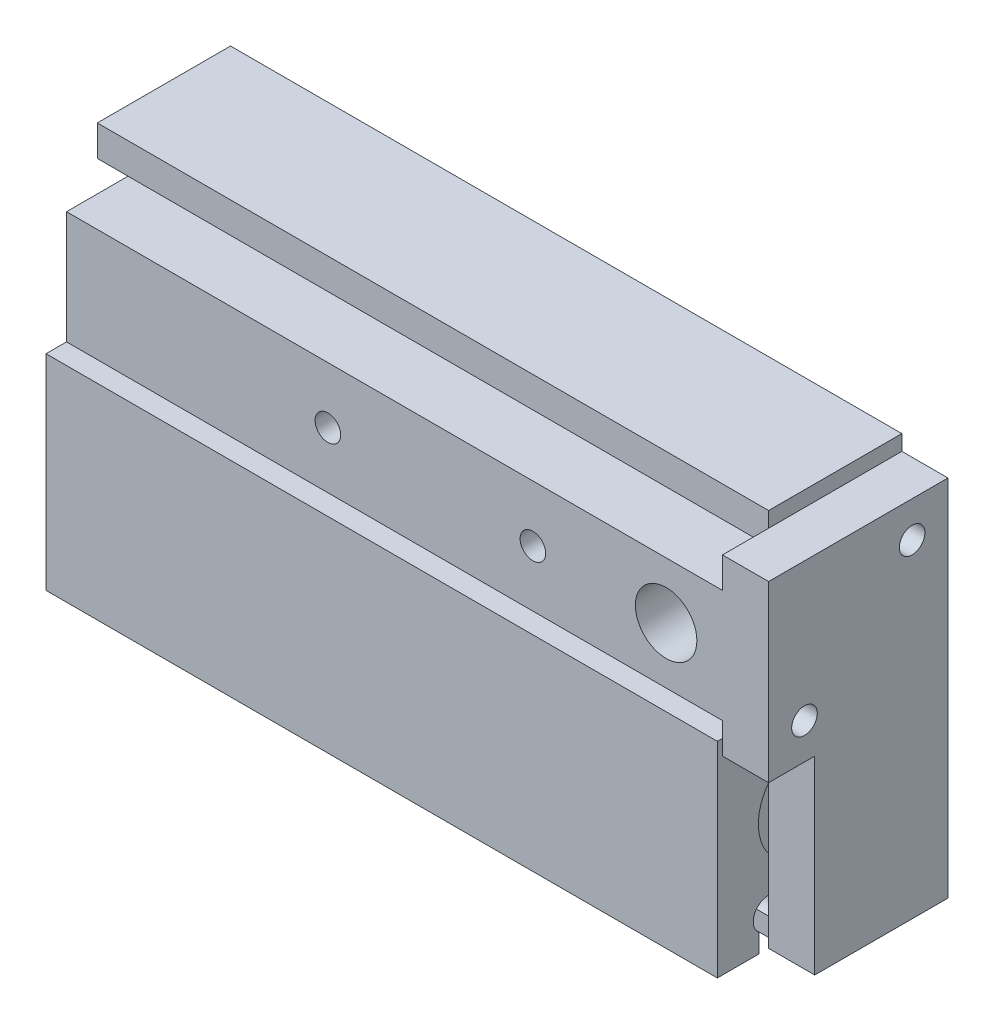
from build123d import *

# Parameters (mm, degrees)
SKETCH_1_W                     = 18
SKETCH_1_H                     = 37
EXTRUDE_1_DEPTH                = 65.5
SKETCH_2_R                     = 5
CUT_EXTRUDE_1_DEPTH            = 0.5
CUT_EXTRUDE_START              = -0.5
SKETCH_3_R                     = 5
CUT_EXTRUDE_2_DEPTH            = 0.5
SKETCH_4_R                     = 1.5
CUT_EXTRUDE_3_DEPTH            = 78.351470574
SKETCH_5_W                     = 1.835428096
SKETCH_5_H                     = 2.75652024
CUT_EXTRUDE_4_DEPTH            = 78.351470574
SKETCH_6_W                     = 5
SKETCH_6_H                     = 17
CUT_EXTRUDE_5_DEPTH            = 78.351470574
SKETCH_7_W                     = 8
SKETCH_7_H                     = 12
CUT_EXTRUDE_6_DEPTH            = 78.351470574
SKETCH_8_R                     = 2.5
EXTRUDE_2_DEPTH                = 1.5
SKETCH_9_W                     = 17.5
SKETCH_9_H                     = 35.5
EXTRUDE_3_DEPTH                = 4.5
SKETCH_10_W                    = 7
SKETCH_10_H                    = 11
EXTRUDE_4_DEPTH                = 64
CUT_EXTRUDE_7_REACH            = 84.061
SKETCH_11_W                    = 4.5
SKETCH_11_H                    = 18.5
HOLE_WIZARD_M3_1_D             = 2.5
HOLE_WIZARD_M3_1_DEPTH         = 7.5
HOLE_WIZARD_M3_1_TIP           = 0.751075774
HOLE_WIZARD_M3_1_2_D           = 3.4
HOLE_WIZARD_M3_1_2_DEPTH       = 5
HOLE_WIZARD_M3_1_2_CBORE_D     = 6.5
HOLE_WIZARD_M3_1_2_CBORE_DEPTH = 3
CUT_EXTRUDE_8_REACH            = 84.172
SKETCH_16_R                    = 3
HOLE_WIZARD_M3_2_D             = 2.5
HOLE_WIZARD_M3_2_DEPTH         = 7.5
HOLE_WIZARD_M3_2_TIP           = 0.751075774


with BuildPart() as part:
    # 草图1 → 凸台-拉伸1 (new body)
    with BuildSketch(Plane(origin=(0, 0, 0), x_dir=(0, 0, -1), z_dir=(1, 0, 0))):
        with Locations((9, 18.5)):
            Rectangle(SKETCH_1_W, SKETCH_1_H)
    extrude(amount=EXTRUDE_1_DEPTH)

    # 草图2 → 切除-拉伸1 (cut)
    with BuildSketch(Plane.ZY):
        with Locations((-9, 11)):
            Circle(SKETCH_2_R)
    extrude(amount=-CUT_EXTRUDE_1_DEPTH, mode=Mode.SUBTRACT)

    # 草图3 → 切除-拉伸2 (cut)
    with BuildSketch(Plane(origin=(65.5, 0, 0), x_dir=(0, 0, -1), z_dir=(1, 0, 0)).offset(CUT_EXTRUDE_START)):
        with Locations(Location((9, 11, 0), (0, 0, 180))):
            Circle(SKETCH_3_R)
    extrude(amount=CUT_EXTRUDE_2_DEPTH, mode=Mode.SUBTRACT)

    # 草图4 → 切除-拉伸3 (cut, through all)
    with BuildSketch(Plane.ZY):
        with Locations((-13, 3)):
            Circle(SKETCH_4_R)
        with Locations(Location((-5, 3, 0), (0, 0, 180))):
            Circle(SKETCH_4_R)
    extrude(amount=-CUT_EXTRUDE_3_DEPTH, mode=Mode.SUBTRACT)

    # 草图5 → 切除-拉伸4 (cut, through all)
    with BuildSketch(Plane.ZY):
        with Locations((-13, 1.37826012)):
            Rectangle(SKETCH_5_W, SKETCH_5_H)
        with Locations((-5, 1.37826012)):
            Rectangle(SKETCH_5_W, SKETCH_5_H)
    extrude(amount=-CUT_EXTRUDE_4_DEPTH, mode=Mode.SUBTRACT)

    # 草图6 → 切除-拉伸5 (cut, through all)
    with BuildSketch(Plane.ZY):
        with Locations((-2.5, 28.5)):
            Rectangle(SKETCH_6_W, SKETCH_6_H)
    extrude(amount=-CUT_EXTRUDE_5_DEPTH, mode=Mode.SUBTRACT)

    # 草图7 → 切除-拉伸6 (cut, through all)
    with BuildSketch(Plane.ZY):
        with Locations((-9, 28)):
            Rectangle(SKETCH_7_W, SKETCH_7_H)
    extrude(amount=-CUT_EXTRUDE_6_DEPTH, mode=Mode.SUBTRACT)

    # 草图8 → 凸台-拉伸2 (add)
    with BuildSketch(Plane(origin=(65, 0, 0), x_dir=(0, 0, -1), z_dir=(1, 0, 0))):
        with Locations((9, 11)):
            Circle(SKETCH_8_R)
    extrude(amount=EXTRUDE_2_DEPTH)

    # 草图9 → 凸台-拉伸3 (add)
    with BuildSketch(Plane(origin=(66.5, 0, 0), x_dir=(0, 0, -1), z_dir=(1, 0, 0))):
        with Locations((8.25, 18.75)):
            Rectangle(SKETCH_9_W, SKETCH_9_H)
    extrude(amount=EXTRUDE_3_DEPTH)

    # 草图10 → 凸台-拉伸4 (add)
    with BuildSketch(Plane.ZY.offset(-66.5)):
        with Locations((-3, 28)):
            Rectangle(SKETCH_10_W, SKETCH_10_H)
    extrude(amount=EXTRUDE_4_DEPTH)

    # 草图11 → 切除-拉伸7 (cut, up to next)
    with BuildSketch(Plane(origin=(71, 0, 0), x_dir=(0, 0, -1), z_dir=(1, 0, 0)), mode=Mode.PRIVATE) as cut_extrude_7_sk1:
        with Locations((1.75, 10.25)):
            Rectangle(SKETCH_11_W, SKETCH_11_H)
    cut_extrude_7_tool1 = extrude(cut_extrude_7_sk1.sketch, amount=-CUT_EXTRUDE_7_REACH, mode=Mode.PRIVATE) & part.part
    add(cut_extrude_7_tool1.solids().sort_by_distance((71, 10.25, -1.75))[0], mode=Mode.SUBTRACT)

    # Hole Wizard M3 _1
    with Locations(Plane(origin=(71, 0, 0), x_dir=(0, 0, -1), z_dir=(1, 0, 0))):
        with Locations((13.5, 33), (3, 23)):
            Hole(HOLE_WIZARD_M3_1_D / 2, depth=HOLE_WIZARD_M3_1_DEPTH)
            with Locations((0, 0, -(HOLE_WIZARD_M3_1_DEPTH + HOLE_WIZARD_M3_1_TIP / 2))):  # 118° drill point
                Cone(0, HOLE_WIZARD_M3_1_D / 2, HOLE_WIZARD_M3_1_TIP, mode=Mode.SUBTRACT)

    # Hole Wizard M3 _1 2
    with Locations(Plane.XY.offset(-13)):
        with Locations((4, 28), (61.5, 28)):
            CounterBoreHole(HOLE_WIZARD_M3_1_2_D / 2, HOLE_WIZARD_M3_1_2_CBORE_D / 2, HOLE_WIZARD_M3_1_2_CBORE_DEPTH, depth=HOLE_WIZARD_M3_1_2_DEPTH)

    # 草图16 → 切除-拉伸8 (cut, up to next)
    with BuildSketch(Plane.XY.offset(0.5), mode=Mode.PRIVATE) as cut_extrude_8_sk1:
        with Locations((61, 28)):
            Circle(SKETCH_16_R)
    cut_extrude_8_tool1 = extrude(cut_extrude_8_sk1.sketch, amount=-CUT_EXTRUDE_8_REACH, mode=Mode.PRIVATE) & part.part
    add(cut_extrude_8_tool1.solids().sort_by_distance((61, 28, 0.5))[0], mode=Mode.SUBTRACT)

    # M3 螺纹孔2
    with Locations(Plane.XY.offset(0.5)):
        with Locations((28, 28), (48, 28)):
            Hole(HOLE_WIZARD_M3_2_D / 2, depth=HOLE_WIZARD_M3_2_DEPTH)
            with Locations((0, 0, -(HOLE_WIZARD_M3_2_DEPTH + HOLE_WIZARD_M3_2_TIP / 2))):  # 118° drill point
                Cone(0, HOLE_WIZARD_M3_2_D / 2, HOLE_WIZARD_M3_2_TIP, mode=Mode.SUBTRACT)


solid = part.part
